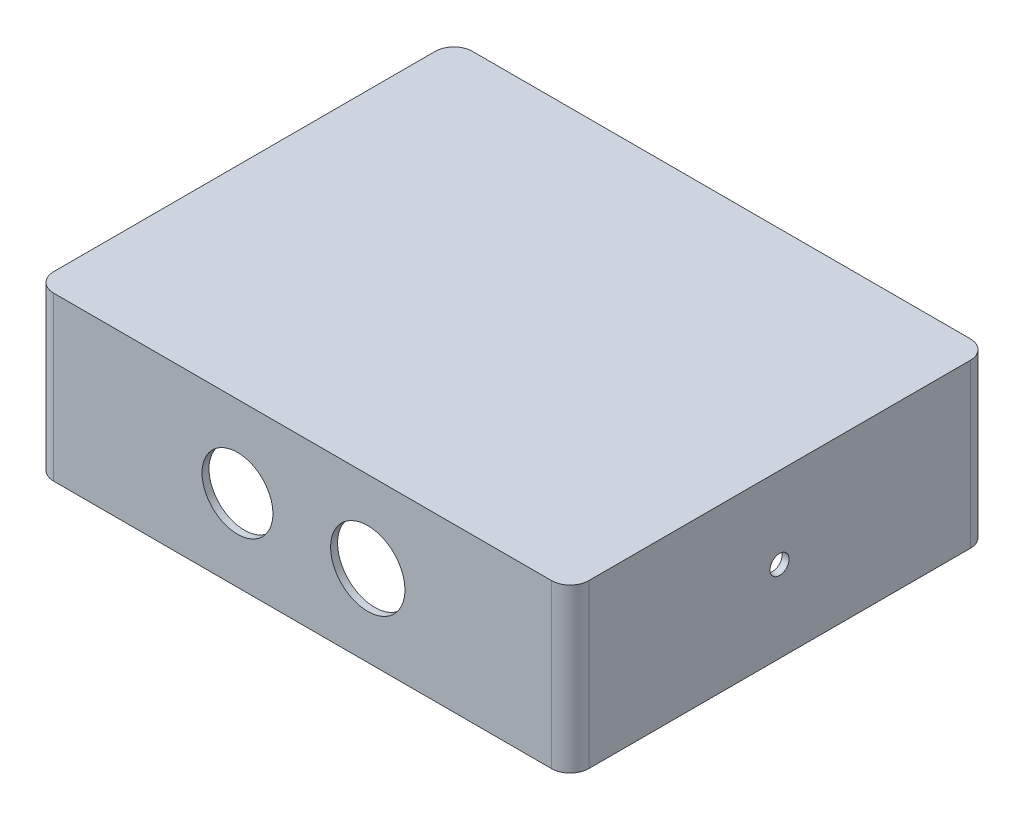
from build123d import *

# Parameters (mm, degrees)
SKETCH_1_W          = 115
SKETCH_1_H          = 90
SKETCH_1_W_2        = 112
SKETCH_1_H_2        = 87
EXTRUDE_1_DEPTH     = 35
SKETCH_3_W          = 115
SKETCH_3_H          = 90
EXTRUDE_2_DEPTH     = 2
SKETCH_4_W          = 20
SKETCH_4_H          = 10
EXTRUDE_3_DEPTH     = 33
FILLET_1_R          = 4
FILLET_2_R          = 4
SKETCH_6_R          = 2.5
CUT_EXTRUDE_1_DEPTH = 33
SKETCH_7_R          = 2.05
CUT_EXTRUDE_2_DEPTH = 170
SKETCH_8_R          = 7.986327153
SKETCH_8_R_2        = 7.617959365
CUT_EXTRUDE_3_DEPTH = 112


with BuildPart() as part:
    # Эскиз1 → Бобышка-Вытянуть1 (new body)
    with BuildSketch(Plane(origin=(0, 0, 0), x_dir=(1, 0, 0), z_dir=(0, 1, 0))):
        with Locations((-57.5, 45)):
            Rectangle(SKETCH_1_W, SKETCH_1_H)
        with Locations((-57.5, 45)):
            Rectangle(SKETCH_1_W_2, SKETCH_1_H_2, mode=Mode.SUBTRACT)
    extrude(amount=EXTRUDE_1_DEPTH)

    # Эскиз3 → Бобышка-Вытянуть2 (add)
    with BuildSketch(Plane(origin=(0, 35, 0), x_dir=(1, 0, 0), z_dir=(0, 1, 0))):
        with Locations((-57.5, 45)):
            Rectangle(SKETCH_3_W, SKETCH_3_H)
    extrude(amount=-EXTRUDE_2_DEPTH)

    # Эскиз4 → Бобышка-Вытянуть3 (add)
    with BuildSketch(Plane.XZ.offset(-33)):
        with Locations((-103.5, -6.5)):
            Rectangle(SKETCH_4_W, SKETCH_4_H)
        with Locations((-103.5, -83.5)):
            Rectangle(SKETCH_4_W, SKETCH_4_H)
        with Locations((-11.5, -83.5)):
            Rectangle(SKETCH_4_W, SKETCH_4_H)
        with Locations((-11.5, -6.5)):
            Rectangle(SKETCH_4_W, SKETCH_4_H)
    extrude(amount=EXTRUDE_3_DEPTH)

    # Скругление1
    fillet_1_edges = [part.edges().sort_by_distance(p)[0] for p in [
        (-113.5, 16.5, -11.5),
        (-93.5, 16.5, -11.5),
        (-93.5, 16.5, -1.5),
        (-113.5, 16.5, -78.5),
        (-93.5, 16.5, -88.5),
        (-93.5, 16.5, -78.5),
        (-1.5, 16.5, -78.5),
        (-21.5, 16.5, -78.5),
        (-21.5, 16.5, -88.5),
        (-1.5, 16.5, -11.5),
        (-21.5, 16.5, -1.5),
        (-21.5, 16.5, -11.5),
    ]]
    fillet(fillet_1_edges, radius=FILLET_1_R)

    # Скругление2
    fillet_2_edges = [part.edges().sort_by_distance(p)[0] for p in [
        (0, 17.5, 0),
        (-115, 17.5, 0),
        (-115, 17.5, -90),
        (0, 17.5, -90),
    ]]
    fillet(fillet_2_edges, radius=FILLET_2_R)

    # Эскиз6 → Вырез-Вытянуть1 (cut)
    with BuildSketch(Plane.XZ):
        with Locations(Location((-107.912454991, -5.546774355, 0), (0, 0, 270))):
            Circle(SKETCH_6_R)
        with Locations(Location((-7.087545009, -84.453225645, 0), (0, 0, 270))):
            Circle(SKETCH_6_R)
        with Locations(Location((-107.912454991, -84.453225645, 0), (0, 0, 270))):
            Circle(SKETCH_6_R)
        with Locations(Location((-7.087545009, -5.546774355, 0), (0, 0, 270))):
            Circle(SKETCH_6_R)
    extrude(amount=-CUT_EXTRUDE_1_DEPTH, mode=Mode.SUBTRACT)

    # Эскиз7 → Вырез-Вытянуть2 (cut)
    with BuildSketch(Plane.ZY.offset(115)):
        with Locations((-45, 17.5)):
            Circle(SKETCH_7_R)
    extrude(amount=-CUT_EXTRUDE_2_DEPTH, mode=Mode.SUBTRACT)

    # Эскиз8 → Вырез-Вытянуть3 (cut)
    with BuildSketch(Plane(origin=(0, 0, -90), x_dir=(-1, 0, 0), z_dir=(0, 0, -1))):
        with Locations((43.5, 17.5)):
            Circle(SKETCH_8_R)
        with Locations((71.5, 17.5)):
            Circle(SKETCH_8_R_2)
    extrude(amount=-CUT_EXTRUDE_3_DEPTH, mode=Mode.SUBTRACT)


solid = part.part
